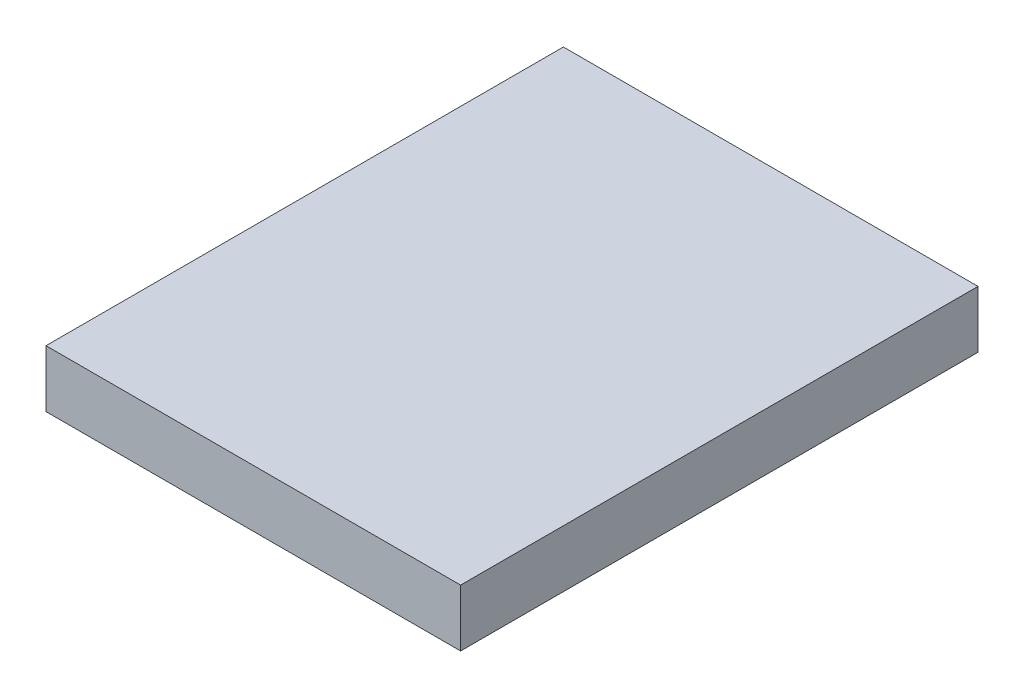
from build123d import *

# Parameters (mm, degrees)
SKETCH1_W           = 11.62
SKETCH1_H           = 14.5
BOSS_EXTRUDE1_DEPTH = 0.8


with BuildPart() as part:
    # Sketch1 → Boss-Extrude1 (new, symmetric)
    with BuildSketch(Plane(origin=(0, 0, 0), x_dir=(1, 0, 0), z_dir=(0, 1, 0))):
        Rectangle(SKETCH1_W, SKETCH1_H)
    extrude(amount=BOSS_EXTRUDE1_DEPTH, both=True)


solid = part.part
